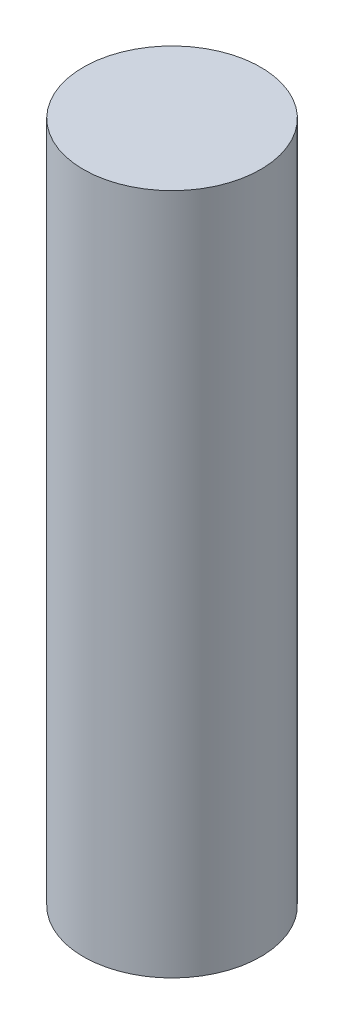
from build123d import *

# Parameters (mm, degrees)
SKETCH1_R           = 13
BOSS_EXTRUDE1_DEPTH = 100
SKETCH2_R           = 10
SKETCH2_R_2         = 5
CUT_EXTRUDE1_DEPTH  = 20


with BuildPart() as part:
    # Sketch1 → Boss-Extrude1 (new body)
    with BuildSketch(Plane(origin=(0, 0, 0), x_dir=(1, 0, 0), z_dir=(0, 1, 0))):
        with Locations(Location((0, 0, 0), (0, 0, 270))):
            Circle(SKETCH1_R)
    extrude(amount=BOSS_EXTRUDE1_DEPTH)

    # Sketch2 → Cut-Extrude1 (cut)
    with BuildSketch(Plane.XZ):
        with Locations(Location((0, 0, 0), (0, 0, 270))):
            Circle(SKETCH2_R)
        with Locations((0, 22)):
            Circle(SKETCH2_R_2)
        with Locations((0, -22)):
            Circle(SKETCH2_R_2)
    extrude(amount=-CUT_EXTRUDE1_DEPTH, mode=Mode.SUBTRACT)


solid = part.part
